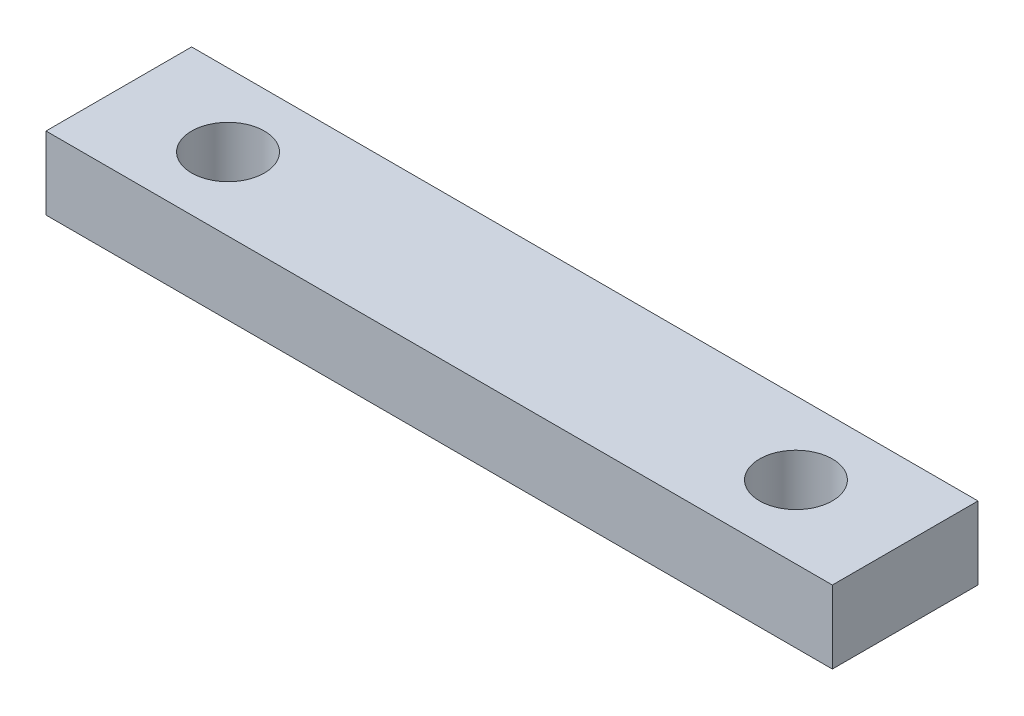
from build123d import *

# Parameters (mm, degrees)
BOSS_EXTRUDE1_DEPTH      = 2.5
BOSS_EXTRUDE1_DEPTH_BACK = 2.5
SKETCH1_W                = 54
SKETCH1_H                = 10
SKETCH1_R                = 2.5


with BuildPart() as part:
    # Sketch1 → Boss-Extrude1 (new, two sides: drawn at the far end of the back side and taken through both)
    with BuildSketch(Plane(origin=(0, 0, 0), x_dir=(1, 0, 0), z_dir=(0, 1, 0)).offset(-BOSS_EXTRUDE1_DEPTH_BACK)):
        Rectangle(SKETCH1_W, SKETCH1_H)
        with Locations((-19.5, 0)):
            Circle(SKETCH1_R, mode=Mode.SUBTRACT)
        with Locations((19.5, 0)):
            Circle(SKETCH1_R, mode=Mode.SUBTRACT)
    extrude(amount=BOSS_EXTRUDE1_DEPTH + BOSS_EXTRUDE1_DEPTH_BACK)


solid = part.part
